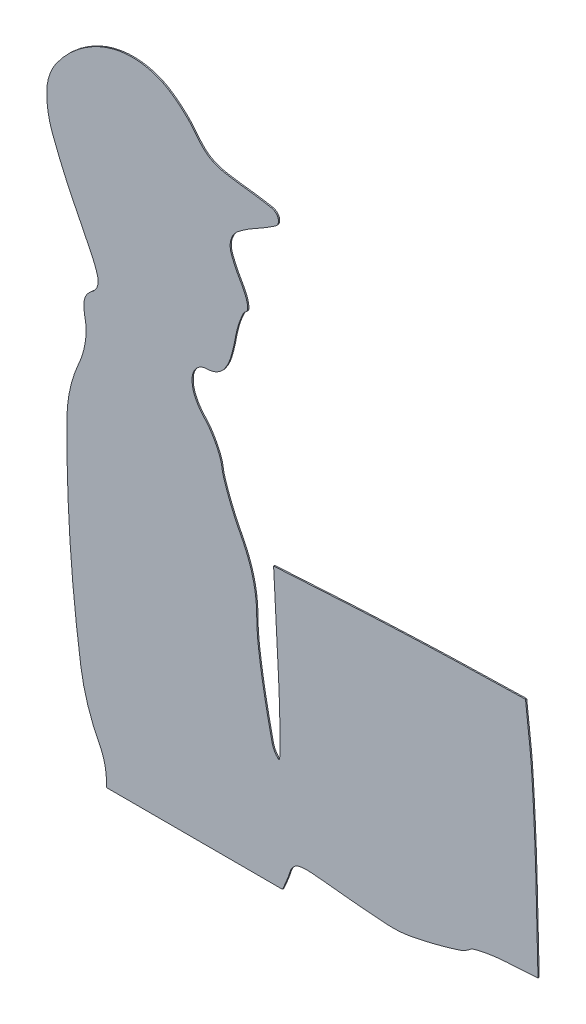
from build123d import *

# Parameters (mm, degrees)
BOSS_EXTRUDE1_DEPTH = 5
SCALE1_SCALE        = 0.25
CUT_EXTRUDE1_DEPTH  = 9952.040834562


with BuildPart() as part:
    # Sketch1 → Boss-Extrude1 (new body)
    with BuildSketch(Plane.XY):
        with BuildLine():
            Line((8159.909536868, 3895.9828862), (7421.165258401, 3895.9828862))
            ThreePointArc((7421.165258401, 3895.9828862), (7429.959757233, 3956.133756514), (7439.347071468, 4016.1949648))
            ThreePointArc((7439.347071468, 4016.1949648), (7442.057058105, 4038.138330196), (7443.133017668, 4060.2222072))
            ThreePointArc((7443.133017668, 4060.2222072), (7442.543853152, 4082.035078261), (7440.274603268, 4103.7375888))
            ThreePointArc((7440.274603268, 4103.7375888), (7436.415665477, 4124.662461933), (7430.913458668, 4145.2164746))
            ThreePointArc((7430.913458668, 4145.2164746), (7423.964160199, 4164.542734661), (7415.342395068, 4183.1830738))
            ThreePointArc((7415.342395068, 4183.1830738), (7366.649289791, 4300.366969321), (7338.094899068, 4424.0105322))
            ThreePointArc((7338.094899068, 4424.0105322), (7311.617514063, 4636.091206316), (7293.356736068, 4849.0367586))
            ThreePointArc((7293.356736068, 4849.0367586), (7283.16506675, 5061.388731689), (7280.732275668, 5273.9712148))
            ThreePointArc((7280.732275668, 5273.9712148), (7293.172954964, 5386.370936028), (7328.431519868, 5493.8200004))
            ThreePointArc((7328.431519868, 5493.8200004), (7337.742486755, 5516.516394407), (7345.620512668, 5539.7490678))
            ThreePointArc((7345.620512668, 5539.7490678), (7351.679501675, 5562.487941162), (7356.118104068, 5585.5978204))
            ThreePointArc((7356.118104068, 5585.5978204), (7358.675346911, 5607.418962099), (7359.578625468, 5629.3708596))
            ThreePointArc((7359.578625468, 5629.3708596), (7358.64353128, 5649.323346959), (7355.713761468, 5669.0817022))
            ThreePointArc((7355.713761468, 5669.0817022), (7352.438408953, 5688.856170487), (7350.484358668, 5708.8045844))
            ThreePointArc((7350.484358668, 5708.8045844), (7350.731092558, 5723.555982664), (7353.357327268, 5738.0738172))
            ThreePointArc((7353.357327268, 5738.0738172), (7357.913478119, 5750.187557278), (7364.778081668, 5761.1592676))
            ThreePointArc((7364.778081668, 5761.1592676), (7374.481910556, 5772.026296144), (7385.610425068, 5781.4291026))
            ThreePointArc((7385.610425068, 5781.4291026), (7398.01145304, 5793.829492828), (7406.069693268, 5809.4057548))
            ThreePointArc((7406.069693268, 5809.4057548), (7409.205500038, 5826.961345847), (7407.131235468, 5844.6737564))
            ThreePointArc((7407.131235468, 5844.6737564), (7397.405888065, 5875.074356912), (7384.906743468, 5904.4435632))
            ThreePointArc((7384.906743468, 5904.4435632), (7349.271802752, 5977.699359954), (7313.051235668, 6050.6673754))
            ThreePointArc((7313.051235668, 6050.6673754), (7264.538537996, 6154.192463034), (7221.586648468, 6260.1455696))
            ThreePointArc((7221.586648468, 6260.1455696), (7202.962216392, 6329.893473487), (7198.229240268, 6401.9298428))
            ThreePointArc((7198.229240268, 6401.9298428), (7208.327627962, 6459.829480371), (7234.099018668, 6512.6516432))
            ThreePointArc((7234.099018668, 6512.6516432), (7278.450459246, 6567.982430359), (7331.161308668, 6615.4177826))
            ThreePointArc((7331.161308668, 6615.4177826), (7371.255904047, 6642.614913272), (7414.119766068, 6665.196982))
            ThreePointArc((7414.119766068, 6665.196982), (7456.605186857, 6681.284240787), (7500.865922268, 6691.5213388))
            ThreePointArc((7500.865922268, 6691.5213388), (7544.005738978, 6695.35494106), (7587.252389068, 6693.0166622))
            ThreePointArc((7587.252389068, 6693.0166622), (7629.101294365, 6684.544162053), (7669.231219268, 6669.9598122))
            ThreePointArc((7669.231219268, 6669.9598122), (7687.071423906, 6660.995785219), (7704.083829268, 6650.5456778))
            ThreePointArc((7704.083829268, 6650.5456778), (7723.738285658, 6636.578881775), (7742.689162268, 6621.6713896))
            ThreePointArc((7742.689162268, 6621.6713896), (7761.223063492, 6605.576097245), (7778.956882468, 6588.6033074))
            ThreePointArc((7778.956882468, 6588.6033074), (7793.459676578, 6572.926250488), (7806.776308668, 6556.2298898))
            ThreePointArc((7806.776308668, 6556.2298898), (7824.288153568, 6534.594395228), (7843.626095268, 6514.5743216))
            ThreePointArc((7843.626095268, 6514.5743216), (7861.138407446, 6500.514759008), (7880.721017268, 6489.5204982))
            ThreePointArc((7880.721017268, 6489.5204982), (7905.19088785, 6480.12428202), (7930.641288268, 6473.8520764))
            ThreePointArc((7930.641288268, 6473.8520764), (7971.910151465, 6467.085615655), (8013.381077068, 6461.6942902))
            ThreePointArc((8013.381077068, 6461.6942902), (8067.363917912, 6454.559115178), (8121.041212268, 6445.404559))
            ThreePointArc((8121.041212268, 6445.404559), (8138.079095113, 6436.987819696), (8148.328229068, 6420.985126))
            ThreePointArc((8148.328229068, 6420.985126), (8147.958554114, 6403.319909513), (8137.129013468, 6389.3586208))
            ThreePointArc((8137.129013468, 6389.3586208), (8094.966850827, 6362.420045394), (8051.605562468, 6337.4574038))
            ThreePointArc((8051.605562468, 6337.4574038), (8016.254088169, 6316.173478471), (7982.846162268, 6291.9527704))
            ThreePointArc((7982.846162268, 6291.9527704), (7965.14376738, 6272.776707326), (7954.151299668, 6249.1068566))
            ThreePointArc((7954.151299668, 6249.1068566), (7951.028071511, 6223.446467623), (7956.049568668, 6198.0891278))
            ThreePointArc((7956.049568668, 6198.0891278), (7971.734620233, 6160.850459902), (7990.691866668, 6125.1662612))
            ThreePointArc((7990.691866668, 6125.1662612), (8000.762138012, 6107.143696767), (8009.969603068, 6088.6654452))
            ThreePointArc((8009.969603068, 6088.6654452), (8016.047939928, 6073.833132114), (8020.623937868, 6058.4707126))
            ThreePointArc((8020.623937868, 6058.4707126), (8022.500085726, 6047.336081708), (8022.739529268, 6036.0470338))
            ThreePointArc((8022.739529268, 6036.0470338), (8020.636730092, 6028.939989003), (8015.532330068, 6023.5662612))
            ThreePointArc((8015.532330068, 6023.5662612), (8009.195844508, 6018.108874521), (8004.557345668, 6011.150538))
            ThreePointArc((8004.557345668, 6011.150538), (7997.991370601, 5996.769043014), (7992.115739868, 5982.0919728))
            ThreePointArc((7992.115739868, 5982.0919728), (7985.859371668, 5963.990215751), (7980.488585068, 5945.6062444))
            ThreePointArc((7980.488585068, 5945.6062444), (7975.595886395, 5925.641483824), (7971.490914468, 5905.5))
            ThreePointArc((7971.490914468, 5905.5), (7963.202516759, 5866.505979596), (7952.742844268, 5828.0374676))
            ThreePointArc((7952.742844268, 5828.0374676), (7942.622738577, 5802.18235471), (7928.532910468, 5778.2578872))
            ThreePointArc((7928.532910468, 5778.2578872), (7914.312792497, 5762.426629388), (7896.736631668, 5750.4300028))
            ThreePointArc((7896.736631668, 5750.4300028), (7876.797851436, 5742.943788587), (7855.652461868, 5740.4))
            ThreePointArc((7855.652461868, 5740.4), (7833.06117745, 5735.770794595), (7814.111295268, 5722.6293472))
            ThreePointArc((7814.111295268, 5722.6293472), (7800.625645953, 5702.411513354), (7794.847579668, 5678.805635))
            ThreePointArc((7794.847579668, 5678.805635), (7796.545614851, 5648.156560732), (7805.556702268, 5618.8129178))
            ThreePointArc((7805.556702268, 5618.8129178), (7822.244130559, 5588.65723219), (7843.856447868, 5561.810568))
            ThreePointArc((7843.856447868, 5561.810568), (7856.851272323, 5547.078526973), (7868.590790068, 5531.327901))
            ThreePointArc((7868.590790068, 5531.327901), (7880.434244011, 5512.842904125), (7891.165598868, 5493.6908668))
            ThreePointArc((7891.165598868, 5493.6908668), (7900.407931641, 5474.615006331), (7908.488906868, 5455.0189096))
            ThreePointArc((7908.488906868, 5455.0189096), (7913.694485935, 5438.548815663), (7917.061203668, 5421.6069368))
            ThreePointArc((7917.061203668, 5421.6069368), (7920.537066159, 5402.807304315), (7925.564666468, 5384.3619516))
            ThreePointArc((7925.564666468, 5384.3619516), (7934.341752468, 5358.05001307), (7943.863918668, 5331.9984546))
            ThreePointArc((7943.863918668, 5331.9984546), (7955.253440351, 5303.373845116), (7967.441697268, 5275.0801026))
            ThreePointArc((7967.441697268, 5275.0801026), (7979.978165649, 5248.208790026), (7993.353964468, 5221.7452588))
            ThreePointArc((7993.353964468, 5221.7452588), (8008.827422266, 5190.352430352), (8022.662465668, 5158.2038822))
            ThreePointArc((8022.662465668, 5158.2038822), (8033.919110917, 5127.319244902), (8043.234078068, 5095.7945836))
            ThreePointArc((8043.234078068, 5095.7945836), (8050.366116697, 5064.521655775), (8055.484523468, 5032.8567872))
            ThreePointArc((8055.484523468, 5032.8567872), (8058.676490956, 5000.36791015), (8059.892388668, 4967.7452588))
            ThreePointArc((8059.892388668, 4967.7452588), (8062.146919929, 4908.043474754), (8068.076192468, 4848.5940874))
            ThreePointArc((8068.076192468, 4848.5940874), (8079.3339327, 4771.037647282), (8092.744520068, 4693.8243436))
            ThreePointArc((8092.744520068, 4693.8243436), (8107.523130761, 4618.735104601), (8123.569147268, 4543.906457))
            ThreePointArc((8123.569147268, 4543.906457), (8132.482196436, 4520.577504142), (8147.704125668, 4500.7791366))
            ThreePointArc((8147.704125668, 4500.7791366), (8152.01883888, 4499.953619205), (8154.491132668, 4503.5848714))
            ThreePointArc((8154.491132668, 4503.5848714), (8155.031277256, 4546.845391368), (8155.206117268, 4590.10893))
            ThreePointArc((8155.206117268, 4590.10893), (8154.739906832, 4644.056112547), (8153.360934268, 4697.987683))
            ThreePointArc((8153.360934268, 4697.987683), (8150.810585909, 4763.860495746), (8147.644715068, 4829.7065966))
            Line((8147.644715068, 4829.7065966), (8129.356359468, 5176.3131932))
            Line((8129.356359468, 5176.3131932), (8392.628223068, 5191.5497642))
            ThreePointArc((8392.628223068, 5191.5497642), (8452.217200818, 5194.850498435), (8511.821787068, 5197.8562286))
            ThreePointArc((8511.821787068, 5197.8562286), (8582.459494264, 5201.13735977), (8653.106696268, 5204.20727))
            ThreePointArc((8653.106696268, 5204.20727), (8723.294473888, 5207.046936631), (8793.490438868, 5209.6764488))
            ThreePointArc((8793.490438868, 5209.6764488), (8851.571782083, 5211.612400196), (8909.662495068, 5213.2431676))
            Line((8909.662495068, 5213.2431676), (9163.424878068, 5219.7))
            Line((9163.424878068, 5219.7), (9181.061596668, 5061.968921))
            ThreePointArc((9181.061596668, 5061.968921), (9185.186457728, 5020.933901888), (9188.393763868, 4979.8169898))
            ThreePointArc((9188.393763868, 4979.8169898), (9192.342788293, 4917.491762082), (9195.867790068, 4855.1411152))
            ThreePointArc((9195.867790068, 4855.1411152), (9199.342692766, 4785.239113273), (9202.341767468, 4715.3150804))
            ThreePointArc((9202.341767468, 4715.3150804), (9204.77260272, 4647.350081584), (9206.699213668, 4579.368921))
            Line((9206.699213668, 4579.368921), (9214.700112068, 4254.5))
            Line((9214.700112068, 4254.5), (9088.345043468, 4246.5253144))
            ThreePointArc((9088.345043468, 4246.5253144), (9063.12984847, 4244.553818817), (9037.985123868, 4241.8269748))
            ThreePointArc((9037.985123868, 4241.8269748), (9014.50527641, 4238.489225169), (8991.162332068, 4234.2998626))
            ThreePointArc((8991.162332068, 4234.2998626), (8971.847637204, 4230.127440703), (8952.685827868, 4225.301303))
            ThreePointArc((8952.685827868, 4225.301303), (8943.320399297, 4221.658340598), (8934.945045468, 4216.1053346))
            ThreePointArc((8934.945045468, 4216.1053346), (8914.107795937, 4201.96522706), (8890.945133468, 4192.084707))
            ThreePointArc((8890.945133468, 4192.084707), (8841.751754142, 4177.259598307), (8792.163009468, 4163.8160564))
            ThreePointArc((8792.163009468, 4163.8160564), (8741.092935163, 4151.631759185), (8689.647618868, 4141.1441942))
            ThreePointArc((8689.647618868, 4141.1441942), (8653.876836557, 4136.25558267), (8617.800112068, 4134.8709022))
            ThreePointArc((8617.800112068, 4134.8709022), (8600.252141198, 4135.308149108), (8582.724312268, 4136.2556086))
            ThreePointArc((8582.724312268, 4136.2556086), (8552.726354874, 4138.412142005), (8522.742898068, 4140.7616956))
            ThreePointArc((8522.742898068, 4140.7616956), (8488.095391316, 4143.705558305), (8453.468335068, 4146.8809366))
            ThreePointArc((8453.468335068, 4146.8809366), (8418.408399488, 4150.327961038), (8383.371345468, 4154.0002772))
            ThreePointArc((8383.371345468, 4154.0002772), (8333.066774916, 4159.085748315), (8282.696870668, 4163.4771696))
            ThreePointArc((8282.696870668, 4163.4771696), (8260.113269408, 4163.947926853), (8237.632292268, 4161.7464898))
            ThreePointArc((8237.632292268, 4161.7464898), (8224.348657103, 4157.522741577), (8212.922740468, 4149.5387926))
            ThreePointArc((8212.922740468, 4149.5387926), (8203.561730816, 4138.049212346), (8197.367196268, 4124.5856802))
            ThreePointArc((8197.367196268, 4124.5856802), (8193.839544996, 4113.879184523), (8190.028653668, 4103.2702034))
            ThreePointArc((8190.028653668, 4103.2702034), (8185.30155337, 4090.953742001), (8180.370151268, 4078.717649))
            ThreePointArc((8180.370151268, 4078.717649), (8175.306818889, 4066.734391378), (8170.044086068, 4054.8373564))
            ThreePointArc((8170.044086068, 4054.8373564), (8165.503514288, 4045.18960194), (8160.674610268, 4035.6828862))
            ThreePointArc((8160.674610268, 4035.6828862), (8156.167987226, 4024.816677054), (8153.723036668, 4013.3098804))
            ThreePointArc((8153.723036668, 4013.3098804), (8152.129610207, 3995.54882971), (8151.532769268, 3977.7264362))
            ThreePointArc((8151.532769268, 3977.7264362), (8151.973946563, 3957.222564248), (8153.520801868, 3936.7723652))
            ThreePointArc((8153.520801868, 3936.7723652), (8156.175830482, 3916.293150651), (8159.909536868, 3895.9828862))
        make_face()
    extrude(amount=BOSS_EXTRUDE1_DEPTH)


with BuildPart() as part_1:
    # Scale1: scaled about (8030.539044215, 5033.495022167, 2.5)
    add(part.part.scale(SCALE1_SCALE).moved(Location((6022.904283161, 3775.121266625, 1.875))))

    # Sketch2 → Cut-Extrude1 (cut, through all)
    with BuildSketch(Plane.XY.offset(3.125)):
        Polygon((7883.557876455, 4786.562283255), (8064.280161733, 4786.41866711), (8074.928509347, 4737.602144253), (7845.01634845, 4737.602144253), align=None)
    extrude(amount=-CUT_EXTRUDE1_DEPTH, mode=Mode.SUBTRACT)


solid = part_1.part
